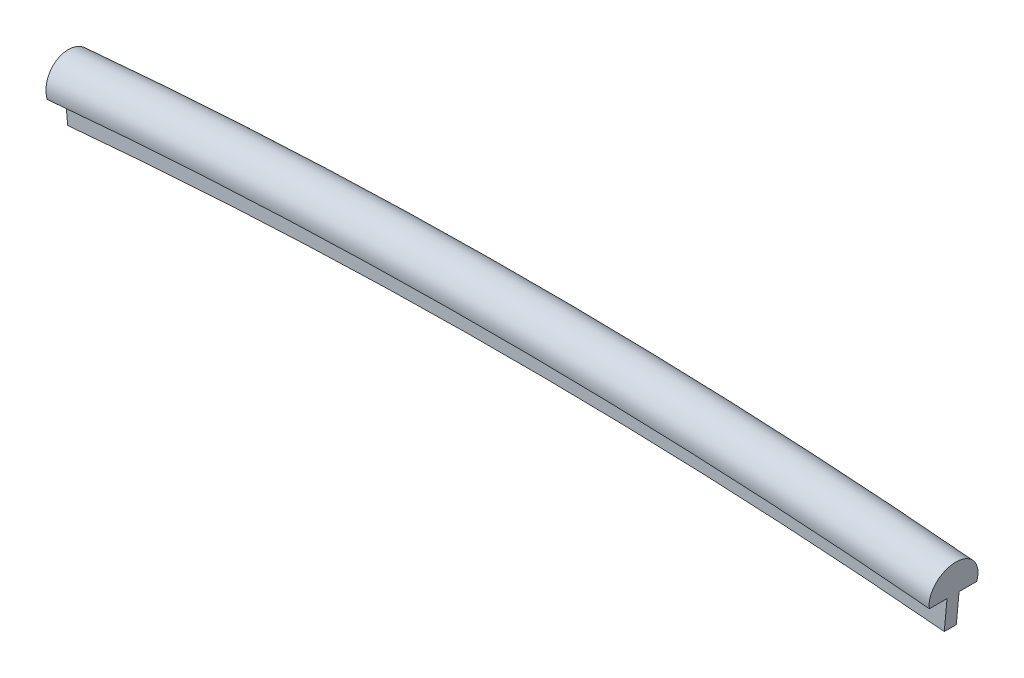
from build123d import *

# Parameters (mm, degrees)
REVOLVE1_ANGLE           = 5.229758018
REVOLVE1_OTHER_WAY_ANGLE = 5.229758018


with BuildPart() as part:
    # Sketch2 → Revolve1 (revolve)
    with BuildSketch(Plane(origin=(0, 0, 0), x_dir=(0, 0, -1), z_dir=(1, 0, 0))):
        with BuildLine():
            Line((0, 239.8), (0.3, 239.8))
            Line((0.3, 239.8), (0.3, 241.3))
            Line((0.3, 241.3), (1.18, 241.3))
            ThreePointArc((1.18, 241.3), (0, 242.800182019), (-1.18, 241.3))
            Line((-1.18, 241.3), (-0.3, 241.3))
            Line((-0.3, 241.3), (-0.3, 239.8))
            Line((-0.3, 239.8), (0, 239.8))
        make_face()
    revolve(axis=Axis((0, 0, 70.597641597), (0, 0, -1)), revolution_arc=REVOLVE1_ANGLE)

    # Sketch2 → Revolve1 other way (revolve)
    with BuildSketch(Plane(origin=(0, 0, 0), x_dir=(0, 0, -1), z_dir=(1, 0, 0))):
        with BuildLine():
            Line((0, 239.8), (0.3, 239.8))
            Line((0.3, 239.8), (0.3, 241.3))
            Line((0.3, 241.3), (1.18, 241.3))
            ThreePointArc((1.18, 241.3), (0, 242.800182019), (-1.18, 241.3))
            Line((-1.18, 241.3), (-0.3, 241.3))
            Line((-0.3, 241.3), (-0.3, 239.8))
            Line((-0.3, 239.8), (0, 239.8))
        make_face()
    revolve(axis=Axis((0, 0, 70.597641597), (0, 0, 1)), revolution_arc=REVOLVE1_OTHER_WAY_ANGLE)


solid = part.part
